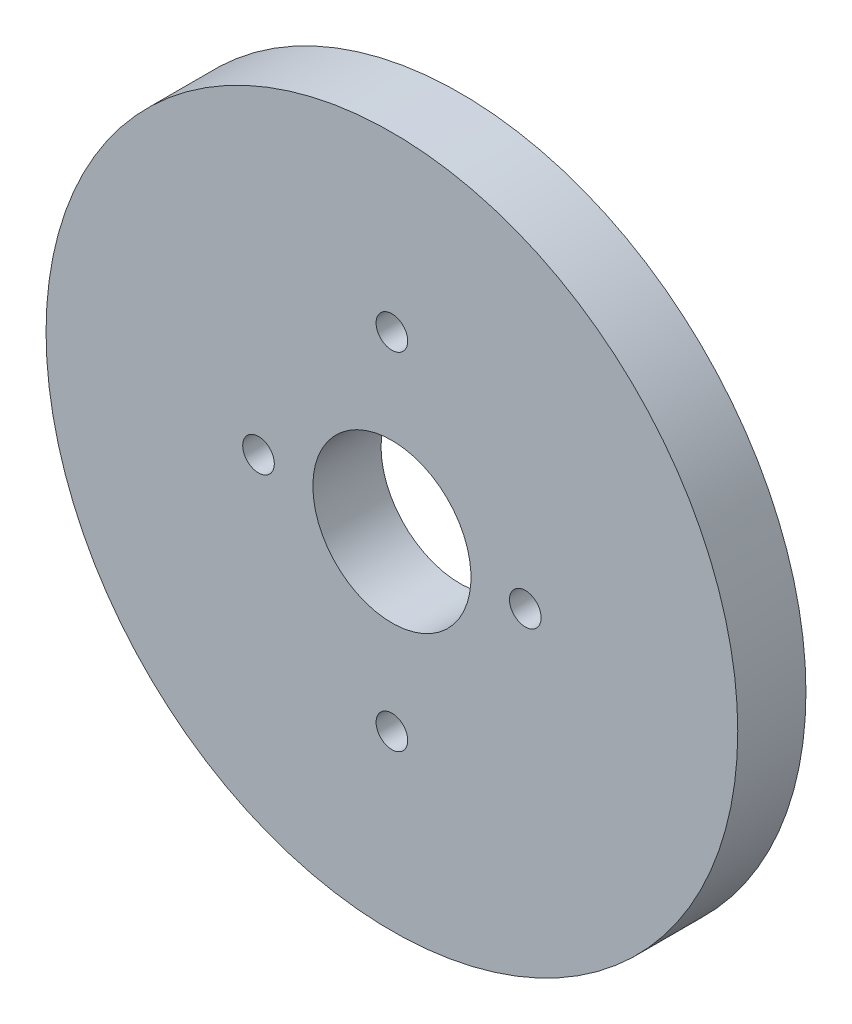
from build123d import *

# Parameters (mm, degrees)
SKETCH1_R           = 17.5
SKETCH1_R_2         = 4
SKETCH1_R_3         = 0.8
BOSS_EXTRUDE1_DEPTH = 3.45


with BuildPart() as part:
    # Sketch1 → Boss-Extrude1 (new body)
    with BuildSketch(Plane.XY):
        with Locations(Location((0, 0, 0), (0, 0, 180))):
            Circle(SKETCH1_R)
        with Locations(Location((0, 0, 0), (0, 0, 180))):
            Circle(SKETCH1_R_2, mode=Mode.SUBTRACT)
        with Locations(Location((6.75, 0, 0), (0, 0, 180))):
            Circle(SKETCH1_R_3, mode=Mode.SUBTRACT)
        with Locations(Location((0, 8.75, 0), (0, 0, 180))):
            Circle(SKETCH1_R_3, mode=Mode.SUBTRACT)
        with Locations(Location((0, -8.75, 0), (0, 0, 180))):
            Circle(SKETCH1_R_3, mode=Mode.SUBTRACT)
        with Locations(Location((-6.75, 0, 0), (0, 0, 180))):
            Circle(SKETCH1_R_3, mode=Mode.SUBTRACT)
    extrude(amount=BOSS_EXTRUDE1_DEPTH)


solid = part.part
